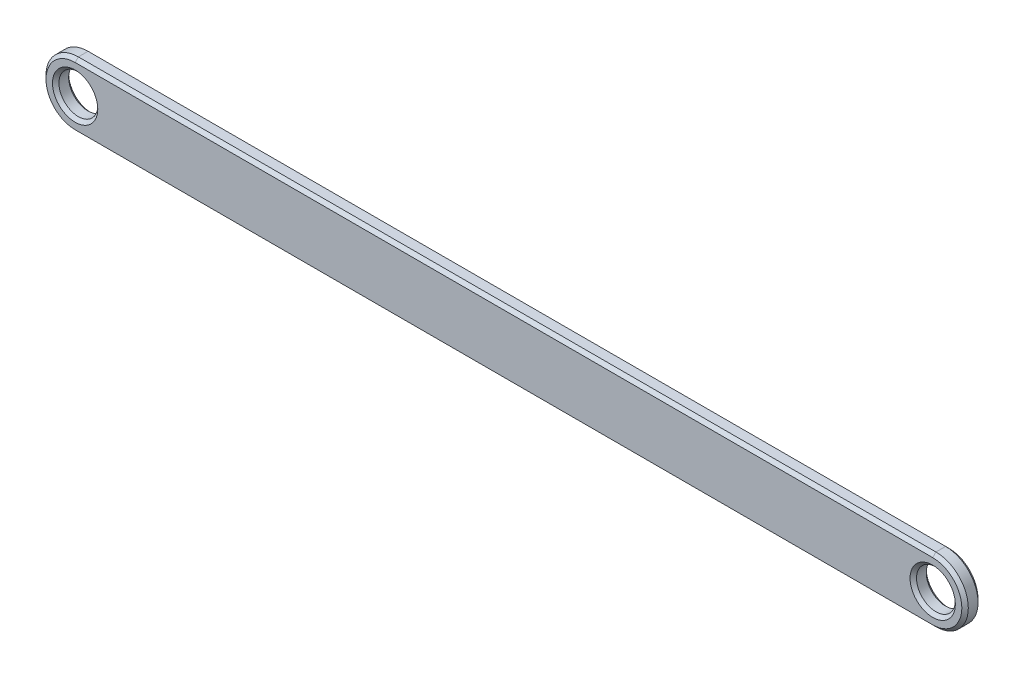
from build123d import *

# Parameters (mm, degrees)
SKETCH1_R           = 30
BOSS_EXTRUDE1_DEPTH = 25
CHAMFER1_SIZE       = 5


with BuildPart() as part:
    # Sketch1 → Boss-Extrude1 (new body)
    with BuildSketch(Plane.XY):
        with BuildLine():
            Line((662.5, -50), (-662.5, -50))
            ThreePointArc((-662.5, -50), (-712.5, 0), (-662.5, 50))
            Line((-662.5, 50), (662.5, 50))
            ThreePointArc((662.5, 50), (712.5, 0), (662.5, -50))
        make_face()
        with Locations((-662.5, 0)):
            Circle(SKETCH1_R, mode=Mode.SUBTRACT)
        with Locations(Location((662.5, 0, 0), (0, 0, 180))):
            Circle(SKETCH1_R, mode=Mode.SUBTRACT)
    extrude(amount=BOSS_EXTRUDE1_DEPTH)

    # Chamfer1
    chamfer1_edges = [part.edges().sort_by_distance(p)[0] for p in [
        (712.5, 0, 25),
        (-692.5, 0, 0),
        (-692.5, 0, 25),
        (0, 50, 25),
        (692.5, 0, 0),
        (692.5, 0, 25),
        (-712.5, 0, 25),
        (0, 50, 0),
        (712.5, 0, 0),
        (0, -50, 0),
        (-712.5, 0, 0),
        (0, -50, 25),
    ]]
    chamfer(chamfer1_edges, length=CHAMFER1_SIZE)


solid = part.part
